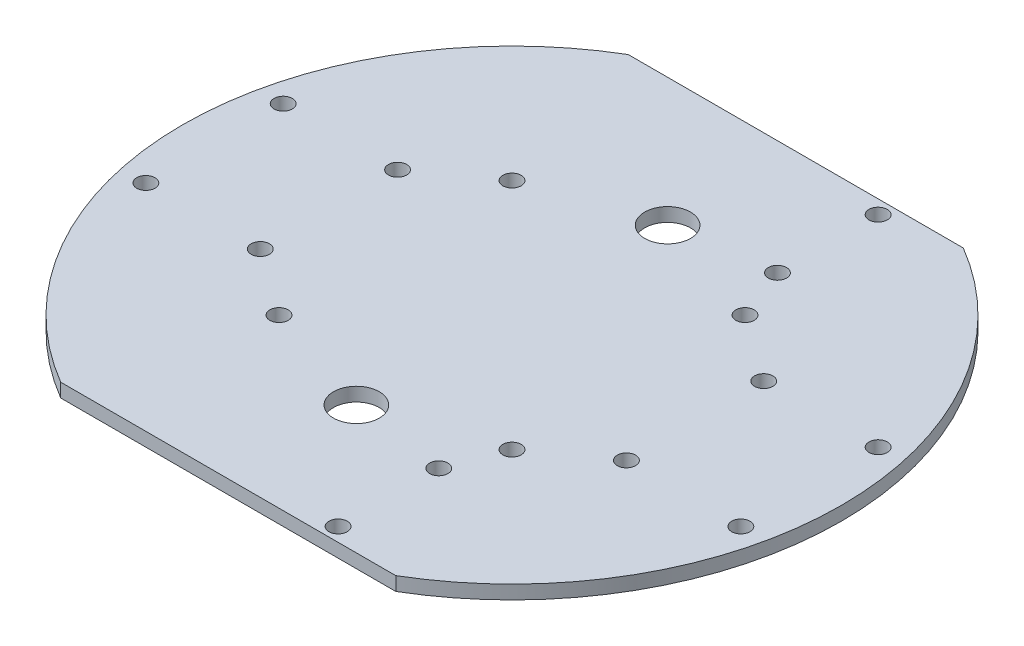
from build123d import *

# Parameters (mm, degrees)
SKETCH1_R           = 2
SKETCH1_R_2         = 5
BOSS_EXTRUDE2_DEPTH = 3


with BuildPart() as part:
    # Sketch1 → Boss-Extrude2 (new body)
    # profile 1 of 2: a face of its own
    with BuildSketch(Plane(origin=(0, 0, 0), x_dir=(1, 0, 0), z_dir=(0, 1, 0))):
        with BuildLine():
            Line((-36.606010435, -62), (0, -62))
            Line((0, -62), (21, -62))
            Line((21, -62), (21, -61))
            ThreePointArc((21, -61), (19, -59), (21, -57))
            Line((21, -57), (21, -39))
            ThreePointArc((21, -39), (19, -37), (21, -35))
            Line((21, -35), (21, 35))
            ThreePointArc((21, 35), (19, 37), (21, 39))
            Line((21, 39), (21, 57))
            ThreePointArc((21, 57), (19, 59), (21, 61))
            Line((21, 61), (21, 62))
            Line((21, 62), (-36.606010435, 62))
            ThreePointArc((-36.606010435, 62), (-72, 0), (-36.606010435, -62))
        make_face()
        with Locations(Location((-65, -15, 0), (0, 0, 270))):
            Circle(SKETCH1_R, mode=Mode.SUBTRACT)
        with Locations(Location((-40, -15, 0), (0, 0, 270))):
            Circle(SKETCH1_R, mode=Mode.SUBTRACT)
        with Locations(Location((-25.455844123, -25.455844123, 0), (0, 0, 270))):
            Circle(SKETCH1_R, mode=Mode.SUBTRACT)
        with Locations(Location((0, -34, 0), (0, 0, 270))):
            Circle(SKETCH1_R_2, mode=Mode.SUBTRACT)
        with Locations(Location((-65, 15, 0), (0, 0, 270))):
            Circle(SKETCH1_R, mode=Mode.SUBTRACT)
        with Locations(Location((-40, 15, 0), (0, 0, 270))):
            Circle(SKETCH1_R, mode=Mode.SUBTRACT)
        with Locations(Location((-25.455844123, 25.455844123, 0), (0, 0, 270))):
            Circle(SKETCH1_R, mode=Mode.SUBTRACT)
        with Locations(Location((0, 34, 0), (0, 0, 270))):
            Circle(SKETCH1_R_2, mode=Mode.SUBTRACT)
    # profile 2 of 2: a face of its own
    with BuildSketch(Plane(origin=(0, 0, 0), x_dir=(1, 0, 0), z_dir=(0, 1, 0))):
        with BuildLine():
            Line((21, -62), (36.606010435, -62))
            ThreePointArc((36.606010435, -62), (62.528524496, -35.695708766), (72, 0))
            ThreePointArc((72, 0), (62.528524496, 35.695708766), (36.606010435, 62))
            Line((36.606010435, 62), (21, 62))
            Line((21, 62), (21, 61))
            ThreePointArc((21, 61), (22.414213562, 60.414213562), (23, 59))
            ThreePointArc((23, 59), (22.414213562, 57.585786438), (21, 57))
            Line((21, 57), (21, 39))
            ThreePointArc((21, 39), (22.414213562, 38.414213562), (23, 37))
            ThreePointArc((23, 37), (22.414213562, 35.585786438), (21, 35))
            Line((21, 35), (21, -35))
            ThreePointArc((21, -35), (22.414213562, -35.585786438), (23, -37))
            ThreePointArc((23, -37), (22.414213562, -38.414213562), (21, -39))
            Line((21, -39), (21, -57))
            ThreePointArc((21, -57), (22.414213562, -57.585786438), (23, -59))
            ThreePointArc((23, -59), (22.414213562, -60.414213562), (21, -61))
            Line((21, -61), (21, -62))
        make_face()
        with Locations(Location((25.455844123, -25.455844123, 0), (0, 0, 270))):
            Circle(SKETCH1_R, mode=Mode.SUBTRACT)
        with Locations(Location((40, -15, 0), (0, 0, 270))):
            Circle(SKETCH1_R, mode=Mode.SUBTRACT)
        with Locations(Location((65, -15, 0), (0, 0, 270))):
            Circle(SKETCH1_R, mode=Mode.SUBTRACT)
        with Locations(Location((25.455844123, 25.455844123, 0), (0, 0, 270))):
            Circle(SKETCH1_R, mode=Mode.SUBTRACT)
        with Locations(Location((40, 15, 0), (0, 0, 270))):
            Circle(SKETCH1_R, mode=Mode.SUBTRACT)
        with Locations(Location((65, 15, 0), (0, 0, 270))):
            Circle(SKETCH1_R, mode=Mode.SUBTRACT)
    extrude(amount=BOSS_EXTRUDE2_DEPTH)


solid = part.part
